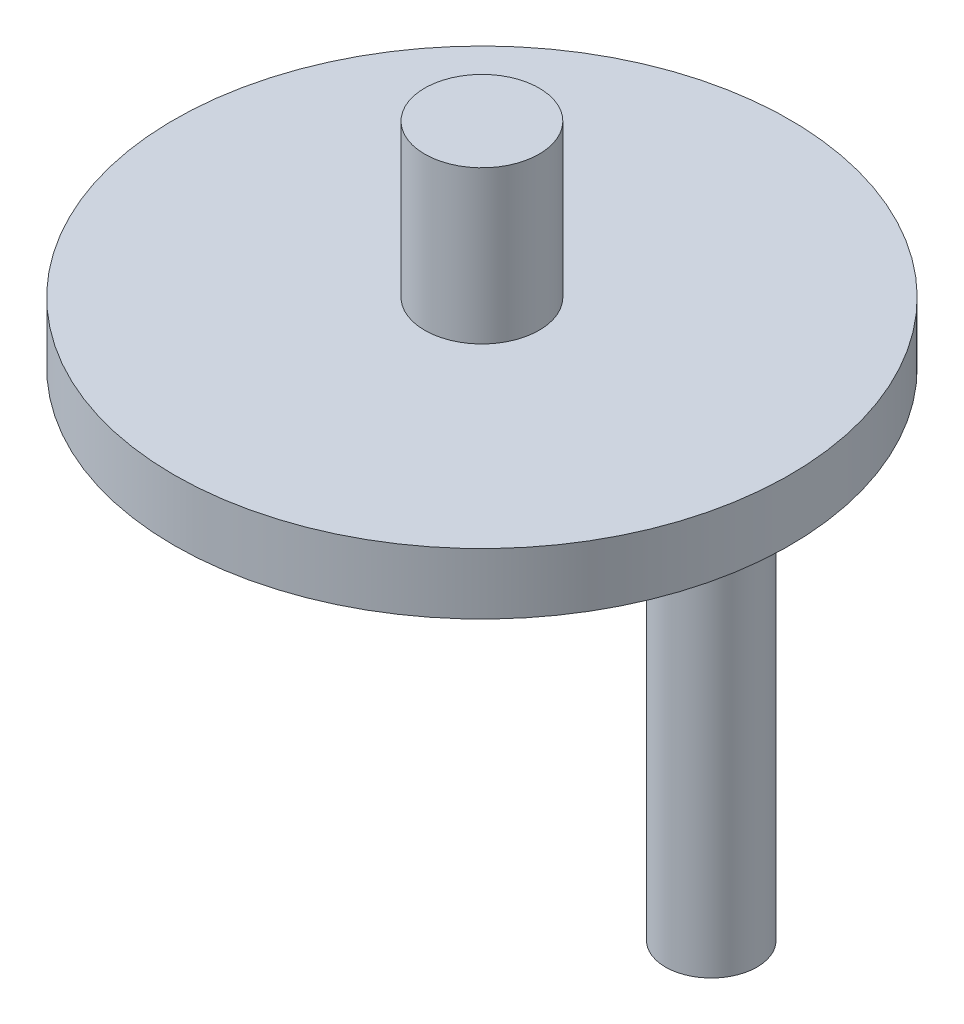
from build123d import *

# Parameters (mm, degrees)
SKETCH1_R           = 40.34
BOSS_EXTRUDE1_DEPTH = 8
SKETCH2_R           = 7.5
BOSS_EXTRUDE2_DEPTH = 20
BOSS_EXTRUDE3_DEPTH = 10
SKETCH4_R           = 6
BOSS_EXTRUDE4_DEPTH = 50


with BuildPart() as part:
    # Sketch1 → Boss-Extrude1 (new body)
    with BuildSketch(Plane(origin=(0, 0, 0), x_dir=(1, 0, 0), z_dir=(0, 1, 0))):
        with Locations(Location((0, 0, 0), (0, 0, 270))):
            Circle(SKETCH1_R)
    extrude(amount=-BOSS_EXTRUDE1_DEPTH)

    # Sketch2 → Boss-Extrude2 (add)
    with BuildSketch(Plane(origin=(0, 0, 0), x_dir=(1, 0, 0), z_dir=(0, 1, 0))):
        with Locations(Location((0, 0, 0), (0, 0, 270))):
            Circle(SKETCH2_R)
    extrude(amount=BOSS_EXTRUDE2_DEPTH)

    # Sketch3 → Boss-Extrude3 (add)
    with BuildSketch(Plane.XZ.offset(8)):
        with BuildLine():
            ThreePointArc((11.103712575, 16.634529361), (-20, 0), (11.103712575, -16.634529361))
            ThreePointArc((11.103712575, -16.634529361), (4.84, 0), (11.103712575, 16.634529361))
        make_face()
    extrude(amount=BOSS_EXTRUDE3_DEPTH)

    # Sketch4 → Boss-Extrude4 (add)
    with BuildSketch(Plane.XZ.offset(8)):
        with Locations(Location((30.06, 0, 0), (0, 0, 90))):
            Circle(SKETCH4_R)
    extrude(amount=BOSS_EXTRUDE4_DEPTH)


solid = part.part
